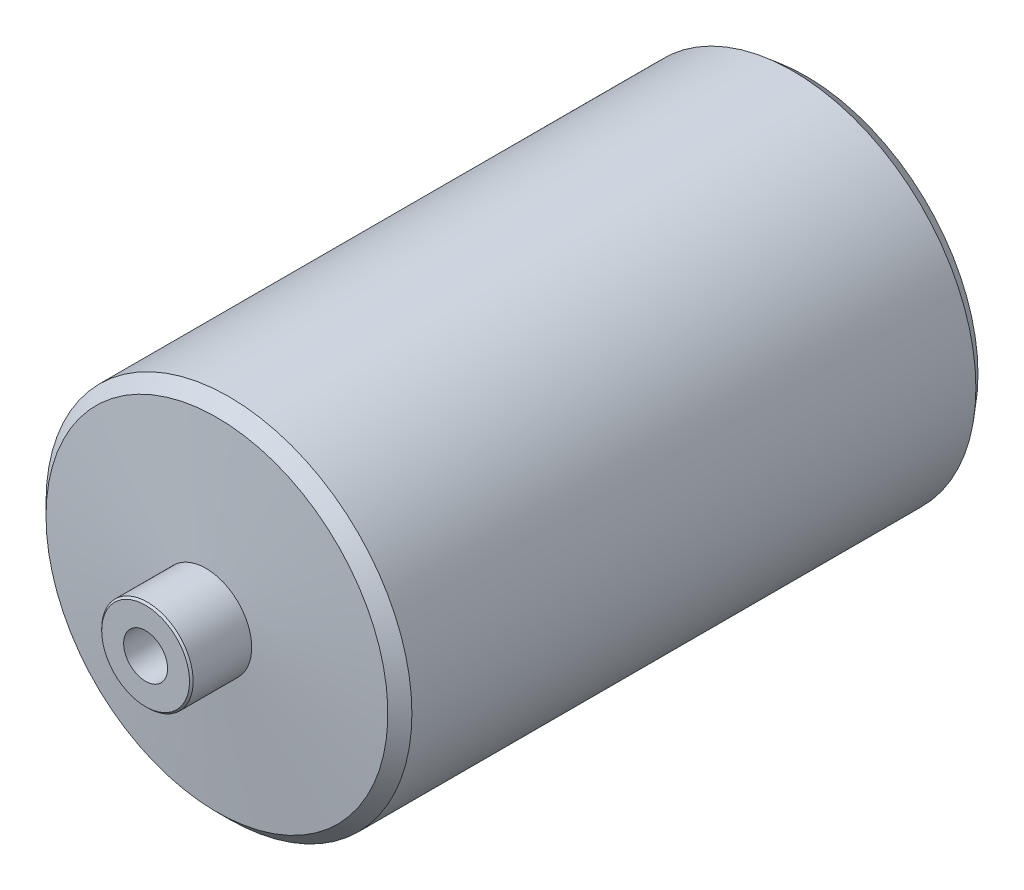
from build123d import *
from OCP.BRepFilletAPI import BRepFilletAPI_MakeChamfer

# Parameters (mm, degrees)
CHAFL_N1_SIZE                     = 3
CHAFL_N1_SIZE2                    = 3.300188603
TALADRO_DE_MARGEN_PARA_M101_D     = 12
TALADRO_DE_MARGEN_PARA_M101_DEPTH = 55.394836286
TALADRO_DE_MARGEN_PARA_M101_TIP   = 3.605163714
TALADRO_DE_MARGEN_PARA_M102_D     = 12
TALADRO_DE_MARGEN_PARA_M102_DEPTH = 55.394836286
TALADRO_DE_MARGEN_PARA_M102_TIP   = 3.605163714
CHAFL_N2_SIZE                     = 0.5


with BuildPart() as part:
    # Croquis1 → Revolución2 (revolve)
    with BuildSketch(Plane(origin=(0, 0, 0), x_dir=(0, 0, -1), z_dir=(1, 0, 0)), mode=Mode.PRIVATE) as revoluci_n2_sk:
        Polygon((0, 0), (0, 12.5), (-16.5, 12.5), (-19.780824882, 50), (-180.219175118, 50), (-183.5, 12.5), (-200, 12.5), (-200, 0), align=None)
    revolve(revoluci_n2_sk.sketch.rotate(Axis((0, 0, 200), (0, 0, -1)), 90), axis=Axis((0, 0, 200), (0, 0, -1)))

    # Chaflán1: one chamfer whose edges measure the first distance from different faces: ONE call of the kernel's chamfer builder (chamfer() names one face for all edges)
    chafl_n1_edges_1 = [part.edges().sort_by_distance(p)[0] for p in [
        (-50, 0, 180.219175118),
    ]]
    chafl_n1_side_1 = [part.faces().sort_by_distance(p)[0] for p in [
        (-50, 0, 100),
    ]]
    chafl_n1_edges_2 = [part.edges().sort_by_distance(p)[0] for p in [
        (-50, 0, 19.780824882),
    ]]
    chafl_n1_side_2 = [part.faces().sort_by_distance(p)[0] for p in [
        (-31.25, 0, 18.140412441),
    ]]
    chafl_n1 = BRepFilletAPI_MakeChamfer(part.part.solid().wrapped)
    for e in chafl_n1_edges_1:
        chafl_n1.Add(CHAFL_N1_SIZE, CHAFL_N1_SIZE2, e.wrapped, chafl_n1_side_1[0].wrapped)  # the first distance lies on this face
    for e in chafl_n1_edges_2:
        chafl_n1.Add(CHAFL_N1_SIZE, CHAFL_N1_SIZE2, e.wrapped, chafl_n1_side_2[0].wrapped)  # the first distance lies on this face
    add(Compound.cast(chafl_n1.Shape()), mode=Mode.REPLACE)

    # Taladro de margen para M101
    with Locations(Plane(origin=(0, 0, 0), x_dir=(-1, 0, 0), z_dir=(0, 0, -1))):
        with Locations((0, 0)):
            Hole(TALADRO_DE_MARGEN_PARA_M101_D / 2, depth=TALADRO_DE_MARGEN_PARA_M101_DEPTH)
            with Locations((0, 0, -(TALADRO_DE_MARGEN_PARA_M101_DEPTH + TALADRO_DE_MARGEN_PARA_M101_TIP / 2))):  # 118° drill point
                Cone(0, TALADRO_DE_MARGEN_PARA_M101_D / 2, TALADRO_DE_MARGEN_PARA_M101_TIP, mode=Mode.SUBTRACT)

    # Taladro de margen para M102
    with Locations(Plane.XY.offset(200)):
        with Locations((0, 0)):
            Hole(TALADRO_DE_MARGEN_PARA_M102_D / 2, depth=TALADRO_DE_MARGEN_PARA_M102_DEPTH)
            with Locations((0, 0, -(TALADRO_DE_MARGEN_PARA_M102_DEPTH + TALADRO_DE_MARGEN_PARA_M102_TIP / 2))):  # 118° drill point
                Cone(0, TALADRO_DE_MARGEN_PARA_M102_D / 2, TALADRO_DE_MARGEN_PARA_M102_TIP, mode=Mode.SUBTRACT)

    # Chaflán2
    chafl_n2_edges = [part.edges().sort_by_distance(p)[0] for p in [
        (-12.5, 0, 200),
        (-12.5, 0, 0),
    ]]
    chamfer(chafl_n2_edges, length=CHAFL_N2_SIZE)


solid = part.part
